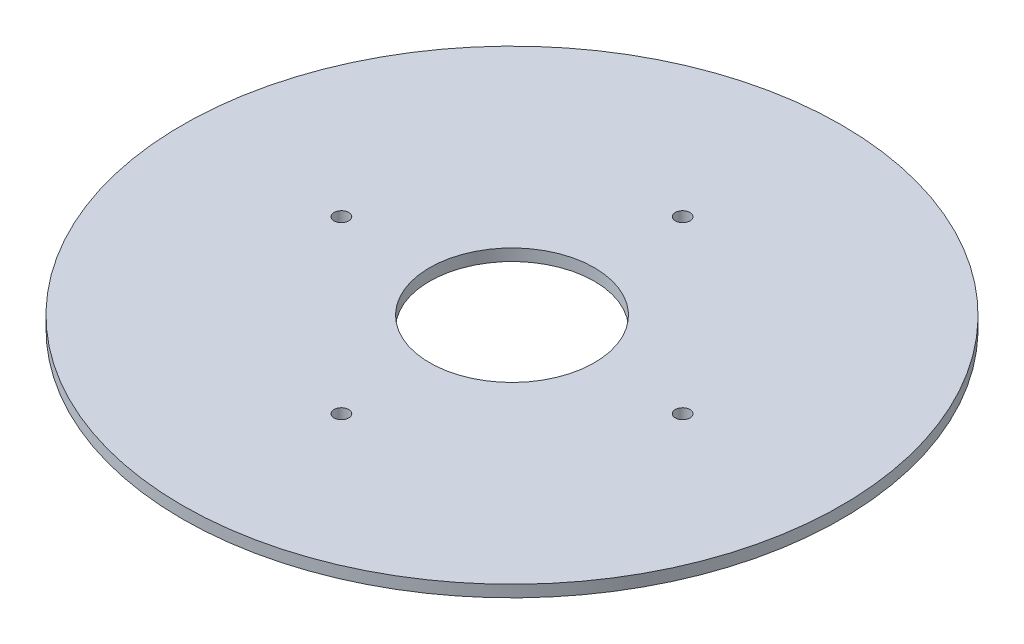
from build123d import *

# Parameters (mm, degrees)
SKETCH1_R           = 88.9
SKETCH1_R_2         = 1.984375
BOSS_EXTRUDE1_DEPTH = 3.175
SKETCH2_R           = 22.225
CUT_EXTRUDE1_DEPTH  = 126.763669734


with BuildPart() as part:
    # Sketch1 → Boss-Extrude1 (new body)
    with BuildSketch(Plane(origin=(0, 0, 0), x_dir=(1, 0, 0), z_dir=(0, 1, 0))):
        with Locations(Location((0, 0, 0), (0, 0, 270))):
            Circle(SKETCH1_R)
        with Locations(Location((0, 46.032792877, 0), (0, 0, 270))):
            Circle(SKETCH1_R_2, mode=Mode.SUBTRACT)
        with Locations(Location((46.032792877, 0, 0), (0, 0, 270))):
            Circle(SKETCH1_R_2, mode=Mode.SUBTRACT)
        with Locations(Location((0, -46.032792877, 0), (0, 0, 270))):
            Circle(SKETCH1_R_2, mode=Mode.SUBTRACT)
        with Locations(Location((-46.032792877, 0, 0), (0, 0, 270))):
            Circle(SKETCH1_R_2, mode=Mode.SUBTRACT)
    extrude(amount=BOSS_EXTRUDE1_DEPTH)

    # Sketch2 → Cut-Extrude1 (cut, through all)
    with BuildSketch(Plane.XZ):
        with Locations(Location((0, 0, 0), (0, 0, 270))):
            Circle(SKETCH2_R)
    extrude(amount=-CUT_EXTRUDE1_DEPTH, mode=Mode.SUBTRACT)


solid = part.part
